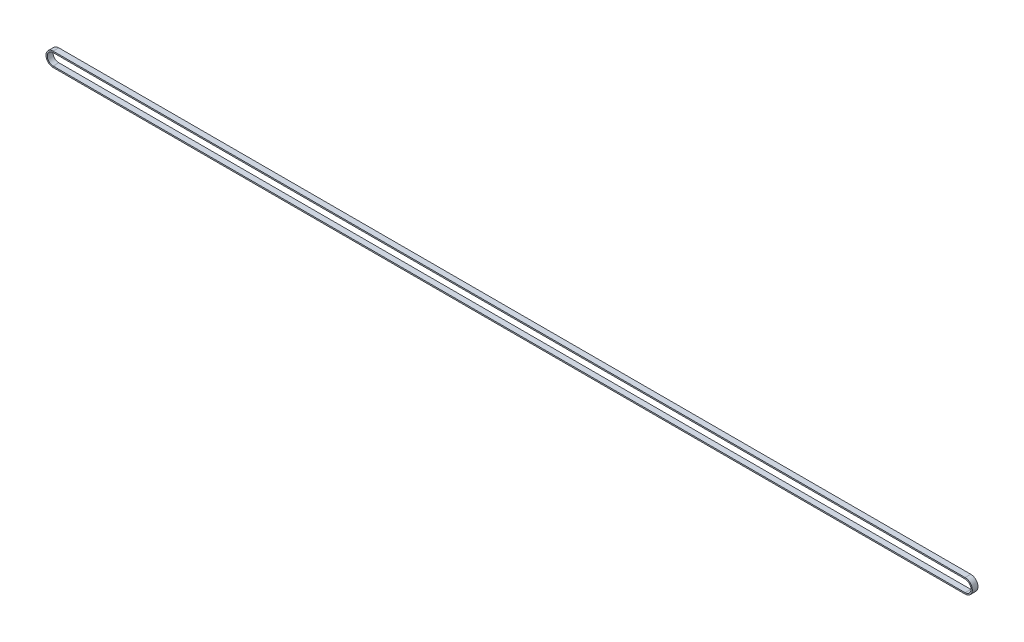
from build123d import *

# Parameters (mm, degrees)
BOSS_EXTRUDE1_DEPTH = 3


with BuildPart() as part:
    # Sketch2 → Boss-Extrude1 (new, symmetric)
    with BuildSketch(Plane.XY):
        with BuildLine():
            Line((-0.000779396, 7.489999959), (960.983485954, 7.589998324))
            ThreePointArc((960.983485954, 7.589998324), (968.57427412, 2e-09), (960.983485954, -7.589999143))
            Line((960.983485954, -7.589999143), (-0.000779396, -7.489999959))
            ThreePointArc((-0.000779396, -7.489999959), (-7.49, 0), (-0.000779396, 7.489999959))
        make_face()
        with BuildLine():
            Line((960.983629554, -6.209998329), (-0.000635796, -6.109999967))
            ThreePointArc((-0.000635796, -6.109999967), (-6.11, 0), (-0.000635796, 6.109999967))
            Line((-0.000635796, 6.109999967), (960.983629554, 6.209998332))
            ThreePointArc((960.983629554, 6.209998332), (967.19427412, 2e-09), (960.983629554, -6.209998329))
        make_face(mode=Mode.SUBTRACT)
    extrude(amount=BOSS_EXTRUDE1_DEPTH, both=True)


solid = part.part
